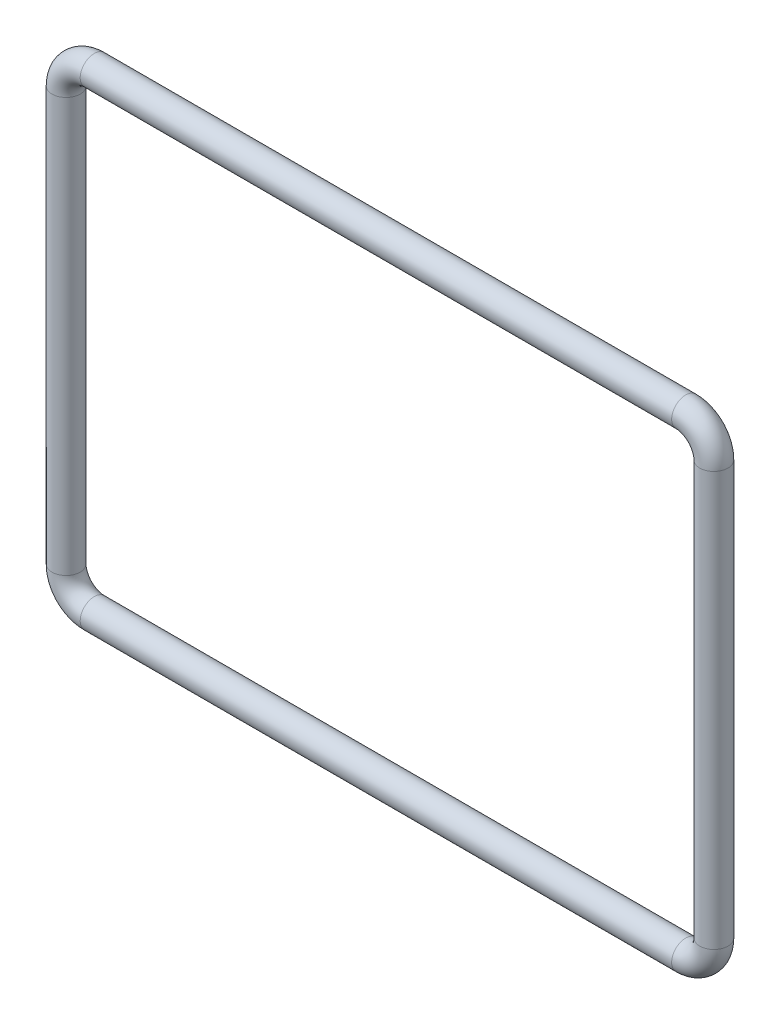
from build123d import *

# Parameters (mm, degrees)
ESBO_O4_R = 4.7625


with BuildPart() as part:
    # Varredura1: sweep along a path in Esboço1
    with BuildLine(Plane.XY) as varredura1_path:
        Line((-200, 149.525), (0, 149.525))
        ThreePointArc((0, 149.525), (6.735192091, 146.735192091), (9.525, 140))
        Line((9.525, 140), (9.525, 0))
        ThreePointArc((9.525, 0), (6.735192091, -6.735192091), (0, -9.525))
        Line((0, -9.525), (-200, -9.525))
        ThreePointArc((-200, -9.525), (-206.735192091, -6.735192091), (-209.525, 0))
        Line((-209.525, 0), (-209.525, 140))
        ThreePointArc((-209.525, 140), (-206.735192091, 146.735192091), (-200, 149.525))
    # Esboço4 → Varredura1 (sweep)
    with BuildSketch(Plane(origin=(-200, 0, 0), x_dir=(0, 0, -1), z_dir=(1, 0, 0))):
        with Locations((0, 149.525)):
            Circle(ESBO_O4_R)
    sweep(path=varredura1_path.line)


solid = part.part
